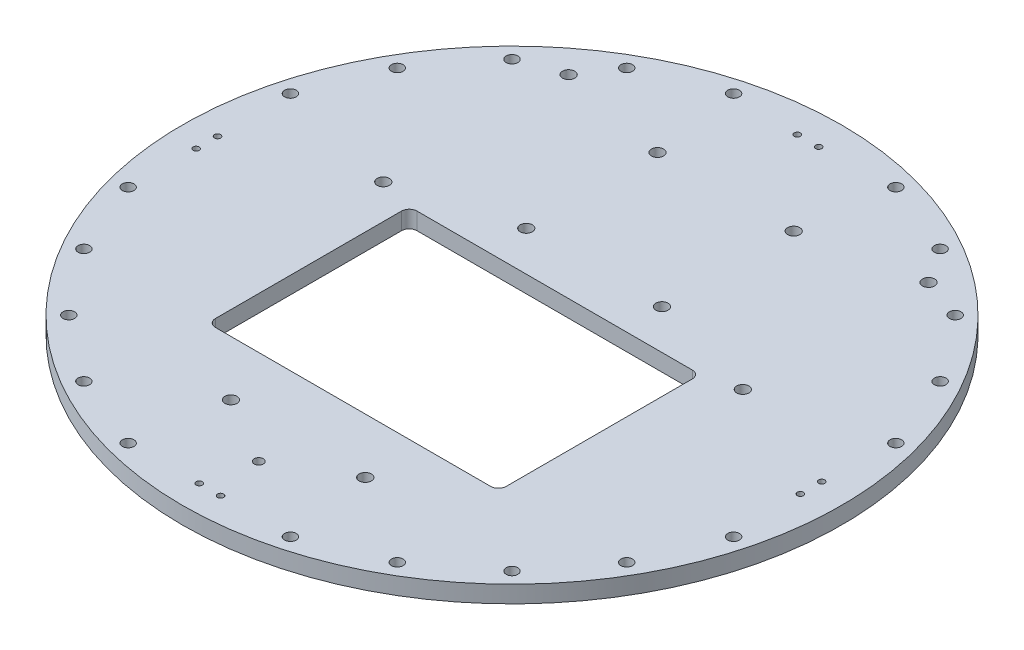
from build123d import *

# Parameters (mm, degrees)
ESQUISSE1_R             = 107.95
BOSS_EXTRU_1_DEPTH      = 5.588
ESQUISSE2_R             = 1.905
ENL_V_MAT_EXTRU_1_DEPTH = 5.588
ENL_V_MAT_EXTRU_2_DEPTH = 5.588
ESQUISSE5_R             = 1
ENL_V_MAT_EXTRU_3_DEPTH = 153.766589096
ESQUISSE6_R             = 2
ENL_V_MAT_EXTRU_4_DEPTH = 153.766589096
ESQUISSE7_R             = 2
ENL_V_MAT_EXTRU_5_DEPTH = 153.766589096
ESQUISSE8_R             = 1.5
ENL_V_MAT_EXTRU_6_DEPTH = 153.766589096


with BuildPart() as part:
    # Esquisse1 → Boss.-Extru.1 (new body)
    with BuildSketch(Plane(origin=(0, 0, 0), x_dir=(1, 0, 0), z_dir=(0, 1, 0))):
        with Locations(Location((0, 0, 0), (0, 0, 270))):
            Circle(ESQUISSE1_R)
    extrude(amount=BOSS_EXTRU_1_DEPTH)

    # Esquisse2 → Enlèv. mat.-Extru.1 (cut)
    with BuildSketch(Plane(origin=(0, 5.588, 0), x_dir=(1, 0, 0), z_dir=(0, 1, 0))):
        with Locations(Location((26.569931805, 99.16033545, 0), (0, 0, 270))):
            Circle(ESQUISSE2_R)
        with Locations(Location((51.329166667, 88.904724577, 0), (0, 0, 270))):
            Circle(ESQUISSE2_R)
        with Locations(Location((72.590403645, 72.590403645, 0), (0, 0, 270))):
            Circle(ESQUISSE2_R)
        with Locations(Location((88.904724577, 51.329166667, 0), (0, 0, 270))):
            Circle(ESQUISSE2_R)
        with Locations(Location((99.16033545, 26.569931805, 0), (0, 0, 270))):
            Circle(ESQUISSE2_R)
        with Locations(Location((99.16033545, -26.569931805, 0), (0, 0, 270))):
            Circle(ESQUISSE2_R)
        with Locations(Location((88.904724577, -51.329166667, 0), (0, 0, 270))):
            Circle(ESQUISSE2_R)
        with Locations(Location((72.590403645, -72.590403645, 0), (0, 0, 270))):
            Circle(ESQUISSE2_R)
        with Locations(Location((51.329166667, -88.904724577, 0), (0, 0, 270))):
            Circle(ESQUISSE2_R)
        with Locations(Location((26.569931805, -99.16033545, 0), (0, 0, 270))):
            Circle(ESQUISSE2_R)
        with Locations(Location((-26.569931805, -99.16033545, 0), (0, 0, 270))):
            Circle(ESQUISSE2_R)
        with Locations(Location((-51.329166667, -88.904724577, 0), (0, 0, 270))):
            Circle(ESQUISSE2_R)
        with Locations(Location((-72.590403645, -72.590403645, 0), (0, 0, 270))):
            Circle(ESQUISSE2_R)
        with Locations(Location((-88.904724577, -51.329166667, 0), (0, 0, 270))):
            Circle(ESQUISSE2_R)
        with Locations(Location((-99.16033545, -26.569931805, 0), (0, 0, 270))):
            Circle(ESQUISSE2_R)
        with Locations(Location((-99.16033545, 26.569931805, 0), (0, 0, 270))):
            Circle(ESQUISSE2_R)
        with Locations(Location((-88.904724577, 51.329166667, 0), (0, 0, 270))):
            Circle(ESQUISSE2_R)
        with Locations(Location((-72.590403645, 72.590403645, 0), (0, 0, 270))):
            Circle(ESQUISSE2_R)
        with Locations(Location((-51.329166667, 88.904724577, 0), (0, 0, 270))):
            Circle(ESQUISSE2_R)
        with Locations(Location((-26.569931805, 99.16033545, 0), (0, 0, 270))):
            Circle(ESQUISSE2_R)
    extrude(amount=-ENL_V_MAT_EXTRU_1_DEPTH, mode=Mode.SUBTRACT)

    # Esquisse3 → Enlèv. mat.-Extru.2 (cut)
    with BuildSketch(Plane(origin=(0, 5.588, 0), x_dir=(1, 0, 0), z_dir=(0, 1, 0))):
        with BuildLine():
            Line((-45.085, -52.07), (45.085, -52.07))
            ThreePointArc((45.085, -52.07), (46.881051224, -51.326051224), (47.625, -49.53))
            Line((47.625, -49.53), (47.625, 11.43))
            ThreePointArc((47.625, 11.43), (46.881051224, 13.226051224), (45.085, 13.97))
            Line((45.085, 13.97), (-45.085, 13.97))
            ThreePointArc((-45.085, 13.97), (-46.881051224, 13.226051224), (-47.625, 11.43))
            Line((-47.625, 11.43), (-47.625, -49.53))
            ThreePointArc((-47.625, -49.53), (-46.881051224, -51.326051224), (-45.085, -52.07))
        make_face()
    extrude(amount=-ENL_V_MAT_EXTRU_2_DEPTH, mode=Mode.SUBTRACT)

    # Esquisse5 → Enlèv. mat.-Extru.3 (cut, through all)
    with BuildSketch(Plane(origin=(0, 5.588, 0), x_dir=(1, 0, 0), z_dir=(0, 1, 0))):
        with Locations(Location((-3.5, -98.95, 0), (0, 0, 270))):
            Circle(ESQUISSE5_R)
        with Locations(Location((3.5, -98.95, 0), (0, 0, 90))):
            Circle(ESQUISSE5_R)
        with Locations(Location((-98.95, 2.5, 0), (0, 0, 270))):
            Circle(ESQUISSE5_R)
        with Locations(Location((-98.95, -4.5, 0), (0, 0, 90))):
            Circle(ESQUISSE5_R)
        with Locations(Location((2.5, 97.95, 0), (0, 0, 270))):
            Circle(ESQUISSE5_R)
        with Locations(Location((-4.5, 97.95, 0), (0, 0, 90))):
            Circle(ESQUISSE5_R)
        with Locations(Location((97.95, -3.5, 0), (0, 0, 270))):
            Circle(ESQUISSE5_R)
        with Locations(Location((97.95, 3.5, 0), (0, 0, 90))):
            Circle(ESQUISSE5_R)
    extrude(amount=-ENL_V_MAT_EXTRU_3_DEPTH, mode=Mode.SUBTRACT)

    # Esquisse6 → Enlèv. mat.-Extru.4 (cut, through all)
    with BuildSketch(Plane(origin=(0, 5.588, 0), x_dir=(1, 0, 0), z_dir=(0, 1, 0))):
        with Locations(Location((-22, -70.07, 0), (0, 0, 270))):
            Circle(ESQUISSE6_R)
        with Locations(Location((22, -70.07, 0), (0, 0, 270))):
            Circle(ESQUISSE6_R)
        with Locations(Location((-22.3, 69.97, 0), (0, 0, 270))):
            Circle(ESQUISSE6_R)
        with Locations(Location((22.3, 69.97, 0), (0, 0, 90))):
            Circle(ESQUISSE6_R)
        with Locations(Location((-58.95, 77.5, 0), (0, 0, 270))):
            Circle(ESQUISSE6_R)
        with Locations(Location((58.95, 77.5, 0), (0, 0, 90))):
            Circle(ESQUISSE6_R)
        with Locations(Location((-22.3, 26.97, 0), (0, 0, 270))):
            Circle(ESQUISSE6_R)
        with Locations(Location((22.15, 26.97, 0), (0, 0, 270))):
            Circle(ESQUISSE6_R)
    extrude(amount=-ENL_V_MAT_EXTRU_4_DEPTH, mode=Mode.SUBTRACT)

    # Esquisse7 → Enlèv. mat.-Extru.5 (cut, through all)
    with BuildSketch(Plane(origin=(0, 5.588, 0), x_dir=(1, 0, 0), z_dir=(0, 1, 0))):
        with Locations(Location((58.881051224, 16.726051224, 0), (0, 0, 270))):
            Circle(ESQUISSE7_R)
        with Locations(Location((-58.881051224, 16.726051224, 0), (0, 0, 90))):
            Circle(ESQUISSE7_R)
    extrude(amount=-ENL_V_MAT_EXTRU_5_DEPTH, mode=Mode.SUBTRACT)

    # Esquisse8 → Enlèv. mat.-Extru.6 (cut, through all)
    with BuildSketch(Plane(origin=(0, 5.588, 0), x_dir=(1, 0, 0), z_dir=(0, 1, 0))):
        with Locations(Location((0, -82.95, 0), (0, 0, 270))):
            Circle(ESQUISSE8_R)
    extrude(amount=-ENL_V_MAT_EXTRU_6_DEPTH, mode=Mode.SUBTRACT)


solid = part.part
